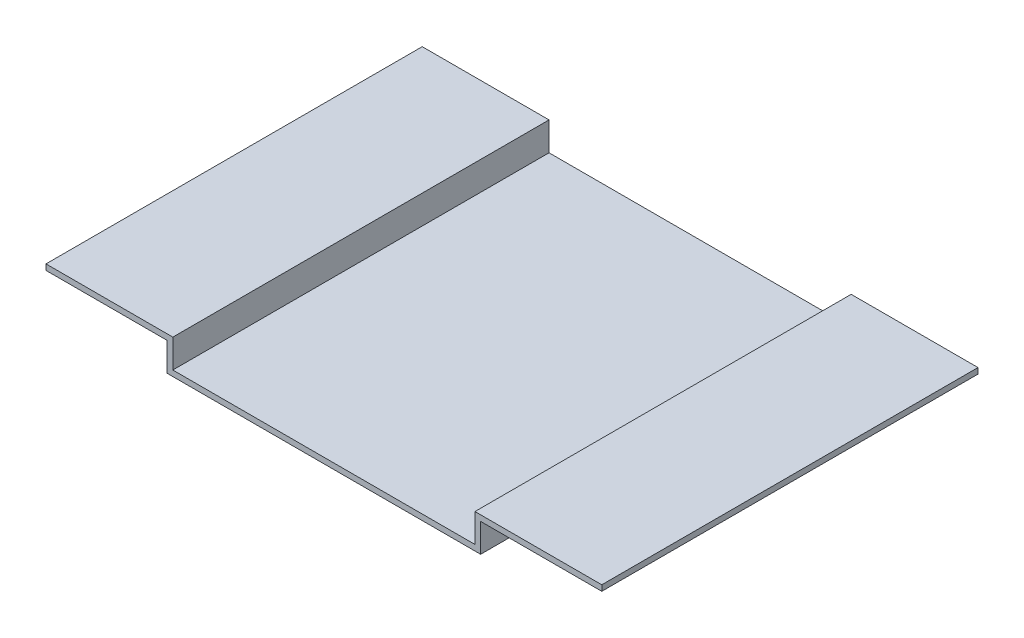
from build123d import *

# Parameters (mm, degrees)
BOSS_EXTRUDE1_DEPTH = 132


with BuildPart() as part:
    # Sketch1 → Boss-Extrude1 (new body)
    with BuildSketch(Plane.XY):
        Polygon((-86.591836735, -12.321428571), (-42.091836735, -12.321428571), (-42.091836735, -22.321428571), (63.908163265, -22.321428571), (63.908163265, -12.321428571), (108.408163265, -12.321428571), (108.408163265, -14.321428571), (65.908163265, -14.321428571), (65.908163265, -24.321428571), (-44.091836735, -24.321428571), (-44.091836735, -14.321428571), (-86.591836735, -14.321428571), align=None)
    extrude(amount=BOSS_EXTRUDE1_DEPTH)


solid = part.part
